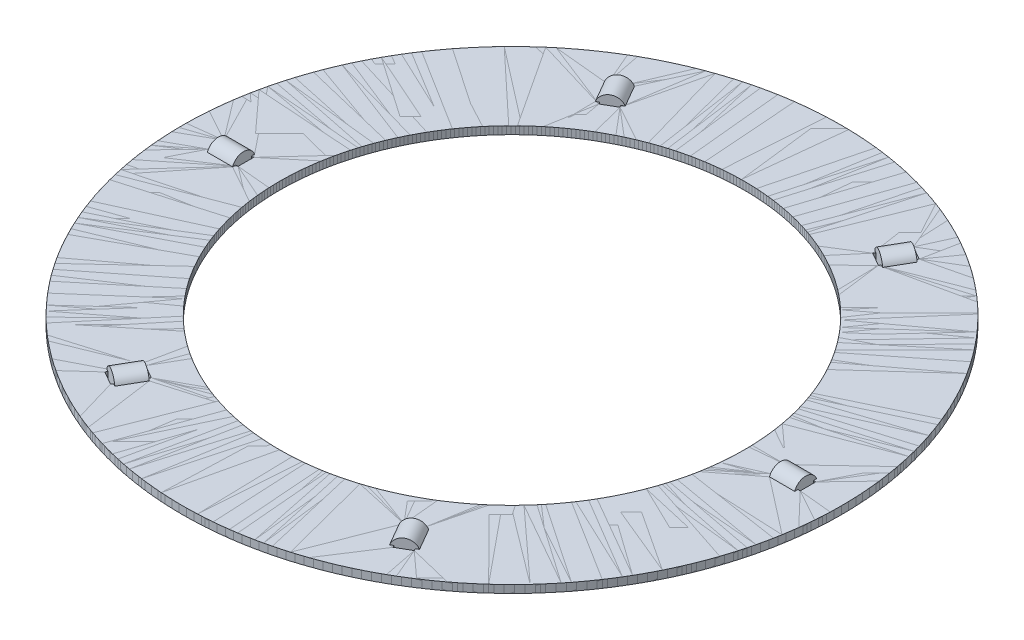
from build123d import *

# Parameters (mm, degrees)
SKETCH_2_W               = 12.5
SKETCH_2_H               = 1
SKETCH_3_W               = 3.85
SKETCH_3_H               = 3
CUT_EXTRUDE_2_DEPTH      = 1
PATTERN_CIRCULAR_1_COUNT = 6
SKETCH_2_6_W             = 3.25
SKETCH_2_6_H             = 1.5
PATTERN_CIRCULAR_2_COUNT = 6


with BuildPart() as part:
    # 草图2 → 旋转1 (revolve)
    with BuildSketch(Plane.XY):
        with Locations((-36.25, 0)):
            Rectangle(SKETCH_2_W, SKETCH_2_H)
    revolve(axis=Axis((0, 87.206131479, 0), (0, -1, 0)))

    # 草图3 → 切除-拉伸2 (cut, symmetric)
    with BuildSketch(Plane.XY):
        with Locations((-36.25, 0)):
            Rectangle(SKETCH_3_W, SKETCH_3_H)
    cut_extrude_2 = extrude(amount=CUT_EXTRUDE_2_DEPTH, both=True, mode=Mode.SUBTRACT)

    # 阵列(圆周)1: 切除-拉伸2 ×6 about axis
    pattern_circular_1_axis = Axis((0, 87.206131479, 0), (0, 1, 0))
    for i in range(1, PATTERN_CIRCULAR_1_COUNT):
        add(cut_extrude_2.rotate(pattern_circular_1_axis, i * 360 / PATTERN_CIRCULAR_1_COUNT), mode=Mode.SUBTRACT)

    # 草图2<6> → 旋转5 (revolve)
    with BuildSketch(Plane.XY):
        with Locations((-36.25, 0.75)):
            Rectangle(SKETCH_2_6_W, SKETCH_2_6_H)
    revolve(axis=Axis((-94.332720146, 0, 0), (1, 0, 0)))


with BuildPart() as pattern_circular_2_1:
    # 阵列(圆周)2: pattern copy
    add(part.part.rotate(Axis((0, 87.206131479, 0), (0, 1, 0)), 1 * 360 / PATTERN_CIRCULAR_2_COUNT))


with BuildPart() as pattern_circular_2_2:
    # 阵列(圆周)2: pattern copy
    add(part.part.rotate(Axis((0, 87.206131479, 0), (0, 1, 0)), 2 * 360 / PATTERN_CIRCULAR_2_COUNT))


with BuildPart() as pattern_circular_2_3:
    # 阵列(圆周)2: pattern copy
    add(part.part.rotate(Axis((0, 87.206131479, 0), (0, 1, 0)), 3 * 360 / PATTERN_CIRCULAR_2_COUNT))


with BuildPart() as pattern_circular_2_4:
    # 阵列(圆周)2: pattern copy
    add(part.part.rotate(Axis((0, 87.206131479, 0), (0, 1, 0)), 4 * 360 / PATTERN_CIRCULAR_2_COUNT))


with BuildPart() as pattern_circular_2_5:
    # 阵列(圆周)2: pattern copy
    add(part.part.rotate(Axis((0, 87.206131479, 0), (0, 1, 0)), 5 * 360 / PATTERN_CIRCULAR_2_COUNT))


solid = Compound([part.part, pattern_circular_2_1.part, pattern_circular_2_2.part, pattern_circular_2_3.part, pattern_circular_2_4.part, pattern_circular_2_5.part])
